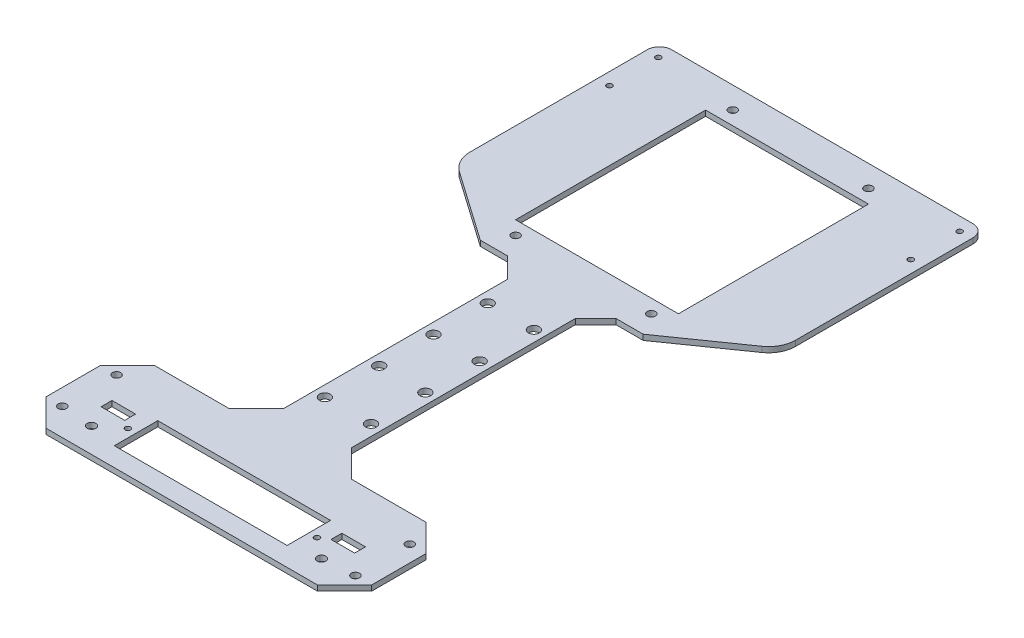
from build123d import *

# Parameters (mm, degrees)
BASE_DEPTH               = 2
ESBO_O2_R                = 1
FURO_BRACKET_MOTOR_DEPTH = 3
ESBO_O4_W                = 60
ESBO_O4_H                = 70
ENCAIXE_PCB_DEPTH        = 236.289901939
ESBO_O6_R                = 1.5
PARAFUSO_PCB_DEPTH       = 236.289901939
ESBO_O7_R                = 2
ENFORCA_GATO_DEPTH       = 236.289901939
ESBO_O8_R                = 1.5
PARAFUSO_APOIO_DEPTH     = 10
ESBO_O9_R                = 1
ESBO_O9_R_2              = 1.6
ESBO_O9_W                = 63.64
ESBO_O9_H                = 16
ESBO_O9_W_2              = 8.7
ESBO_O9_H_2              = 4
CORTE_EXTRUS_O1_DEPTH    = 10


with BuildPart() as part:
    # Esboço1 → Base (new body)
    with BuildSketch(Plane(origin=(0, 0, 0), x_dir=(1, 0, 0), z_dir=(0, 1, 0))):
        with BuildLine():
            Line((-18.088885989, 17.941465294), (-18.088885989, 19.441465294))
            ThreePointArc((-18.088885989, 19.441465294), (-16.770866504, 22.623445809), (-13.588885989, 23.941465294))
            Line((-13.588885989, 23.941465294), (97.411114011, 23.941465294))
            ThreePointArc((97.411114011, 23.941465294), (100.593094526, 22.623445809), (101.911114011, 19.441465294))
            Line((101.911114011, 19.441465294), (101.911114011, 17.941465294))
            Line((101.911114011, 17.941465294), (101.911114011, -45.8528642))
            ThreePointArc((101.911114011, -45.8528642), (100.781222343, -50.470350333), (97.646878374, -54.044384643))
            Line((97.646878374, -54.044384643), (71.911114011, -72.064760852))
            Line((71.911114011, -72.064760852), (61.911114011, -72.064760852))
            Line((61.911114011, -72.064760852), (54.411114011, -79.564760852))
            Line((54.411114011, -79.564760852), (54.411114011, -162.064760852))
            Line((54.411114011, -162.064760852), (64.411114011, -172.064760852))
            Line((64.411114011, -172.064760852), (91.911114011, -172.064760852))
            Line((91.911114011, -172.064760852), (101.911114011, -182.064760852))
            Line((101.911114011, -182.064760852), (101.911114011, -202.064760852))
            Line((101.911114011, -202.064760852), (91.911114011, -212.064760852))
            Line((91.911114011, -212.064760852), (-8.088885989, -212.064760852))
            Line((-8.088885989, -212.064760852), (-18.088885989, -202.064760852))
            Line((-18.088885989, -202.064760852), (-18.088885989, -182.064760852))
            Line((-18.088885989, -182.064760852), (-8.088885989, -172.064760852))
            Line((-8.088885989, -172.064760852), (19.411114011, -172.064760852))
            Line((19.411114011, -172.064760852), (29.411114011, -162.064760852))
            Line((29.411114011, -162.064760852), (29.411114011, -79.564760852))
            Line((29.411114011, -79.564760852), (21.911114011, -72.064760852))
            Line((21.911114011, -72.064760852), (11.911114011, -72.064760852))
            Line((11.911114011, -72.064760852), (-13.824650353, -54.044384643))
            ThreePointArc((-13.824650353, -54.044384643), (-16.958994321, -50.470350333), (-18.088885989, -45.8528642))
            Line((-18.088885989, -45.8528642), (-18.088885989, 17.941465294))
        make_face()
    extrude(amount=BASE_DEPTH)

    # Esboço2 → Furo Bracket Motor (cut)
    with BuildSketch(Plane(origin=(0, 2, 0), x_dir=(1, 0, 0), z_dir=(0, 1, 0))):
        with Locations(Location((-13.588885989, 19.021465294, 0), (0, 0, 270))):
            Circle(ESBO_O2_R)
        with Locations(Location((-13.588885989, 1.021465294, 0), (0, 0, 270))):
            Circle(ESBO_O2_R)
        with Locations(Location((97.411114011, 1.021465294, 0), (0, 0, 90))):
            Circle(ESBO_O2_R)
        with Locations(Location((97.411114011, 19.021465294, 0), (0, 0, 90))):
            Circle(ESBO_O2_R)
    extrude(amount=-FURO_BRACKET_MOTOR_DEPTH, mode=Mode.SUBTRACT)

    # Esboço4 → Encaixe PCB (cut, through all)
    with BuildSketch(Plane.XZ):
        with Locations((41.911114011, 24.063534706)):
            Rectangle(ESBO_O4_W, ESBO_O4_H)
    extrude(amount=-ENCAIXE_PCB_DEPTH, mode=Mode.SUBTRACT)

    # Esboço6 → Parafuso PCB (cut, through all)
    with BuildSketch(Plane.XZ):
        with Locations(Location((16.911114011, 64.063534706, 0), (0, 0, 270))):
            Circle(ESBO_O6_R)
        with Locations(Location((66.911114011, 64.063534706, 0), (0, 0, 270))):
            Circle(ESBO_O6_R)
        with Locations(Location((66.911114011, -15.936465294, 0), (0, 0, 270))):
            Circle(ESBO_O6_R)
        with Locations(Location((16.911114011, -15.936465294, 0), (0, 0, 270))):
            Circle(ESBO_O6_R)
    extrude(amount=-PARAFUSO_PCB_DEPTH, mode=Mode.SUBTRACT)

    # Esboço7 → Enforca Gato (cut, through all)
    with BuildSketch(Plane.XZ):
        with Locations(Location((33.411114011, 90.814760852, 0), (0, 0, 270))):
            Circle(ESBO_O7_R)
        with Locations(Location((33.411114011, 110.814760852, 0), (0, 0, 270))):
            Circle(ESBO_O7_R)
        with Locations(Location((33.411114011, 130.814760852, 0), (0, 0, 270))):
            Circle(ESBO_O7_R)
        with Locations(Location((33.411114011, 150.814760852, 0), (0, 0, 270))):
            Circle(ESBO_O7_R)
        with Locations(Location((50.411114011, 150.814760852, 0), (0, 0, 90))):
            Circle(ESBO_O7_R)
        with Locations(Location((50.411114011, 130.814760852, 0), (0, 0, 90))):
            Circle(ESBO_O7_R)
        with Locations(Location((50.411114011, 110.814760852, 0), (0, 0, 90))):
            Circle(ESBO_O7_R)
        with Locations(Location((50.411114011, 90.814760852, 0), (0, 0, 90))):
            Circle(ESBO_O7_R)
    extrude(amount=-ENFORCA_GATO_DEPTH, mode=Mode.SUBTRACT)

    # Esboço8 → Parafuso Apoio (cut)
    with BuildSketch(Plane.XZ):
        with Locations(Location((95.911114011, 182.064760852, 0), (0, 0, 270))):
            Circle(ESBO_O8_R)
        with Locations(Location((95.911114011, 202.064760852, 0), (0, 0, 270))):
            Circle(ESBO_O8_R)
        with Locations(Location((-12.088885989, 202.064760852, 0), (0, 0, 270))):
            Circle(ESBO_O8_R)
        with Locations(Location((-12.088885989, 182.064760852, 0), (0, 0, 270))):
            Circle(ESBO_O8_R)
    extrude(amount=-PARAFUSO_APOIO_DEPTH, mode=Mode.SUBTRACT)

    # Esboço9 → Corte-extrusão1 (cut)
    with BuildSketch(Plane(origin=(0, 2, 0), x_dir=(1, 0, 0), z_dir=(0, 1, 0))):
        with Locations(Location((76.731114011, -197.064760852, 0), (0, 0, 270))):
            Circle(ESBO_O9_R)
        with Locations(Location((7.091114011, -197.064760852, 0), (0, 0, 270))):
            Circle(ESBO_O9_R)
        with Locations(Location((-0.438885989, -202.924760852, 0), (0, 0, 270))):
            Circle(ESBO_O9_R_2)
        with Locations(Location((84.261114011, -202.924760852, 0), (0, 0, 90))):
            Circle(ESBO_O9_R_2)
        with Locations((41.911114011, -197.064760852)):
            Rectangle(ESBO_O9_W, ESBO_O9_H)
        with Locations((-0.438885989, -193.064760852)):
            Rectangle(ESBO_O9_W_2, ESBO_O9_H_2)
        with Locations((84.261114011, -193.064760852)):
            Rectangle(ESBO_O9_W_2, ESBO_O9_H_2)
    extrude(amount=-CORTE_EXTRUS_O1_DEPTH, mode=Mode.SUBTRACT)


solid = part.part
